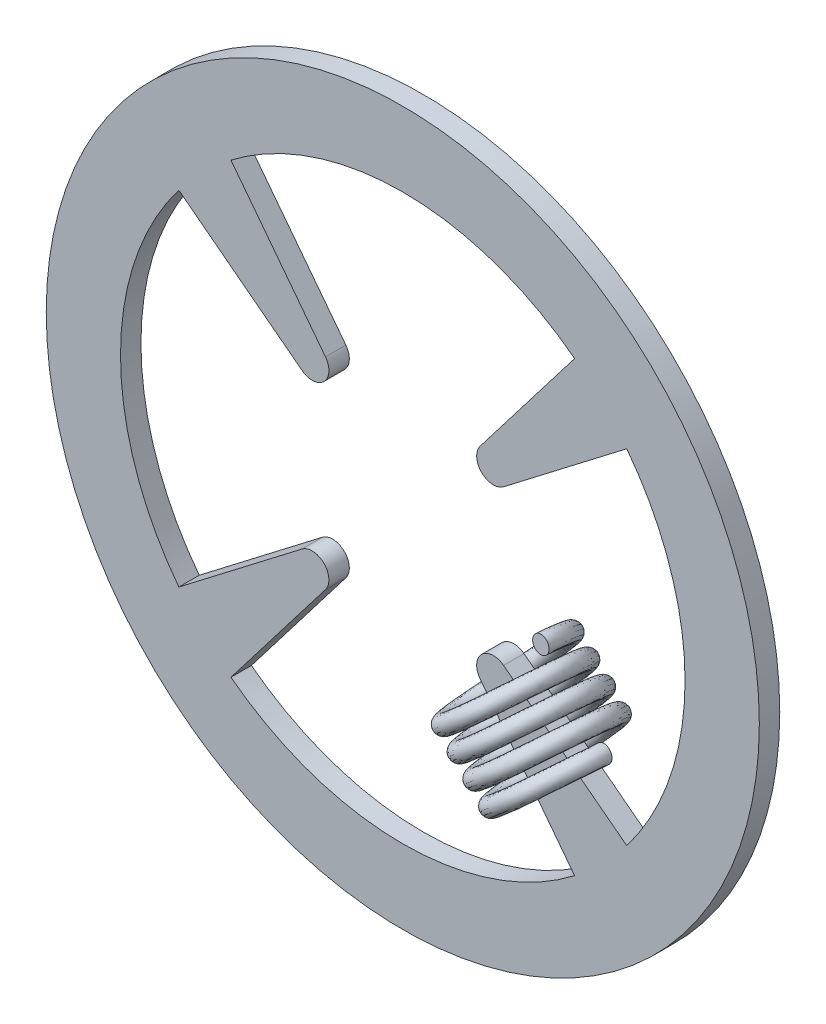
from build123d import *

# Parameters (mm, degrees)
SKETCH_1_R          = 0.96
SKETCH_1_R_2        = 0.76
EXTRUDE_1_DEPTH     = 0.055
EXTRUDE_START       = -0.055
EXTRUDE_2_DEPTH     = 0.055
SWEEP_1_PITCH       = 0.06
SWEEP_1_HEIGHT      = 0.24
SWEEP_1_RADIUS      = 0.15
SWEEP_1_START_ANGLE = 180
SKETCH_71_R         = 0.023


with BuildPart() as part:
    # 草圖1 → 填料-伸長1 (new body)
    with BuildSketch(Plane.XY):
        Circle(SKETCH_1_R)
        Circle(SKETCH_1_R_2, mode=Mode.SUBTRACT)
    extrude(amount=EXTRUDE_1_DEPTH)

    # 草圖2 → 填料-伸長2 (add)
    with BuildSketch(Plane.XY.offset(0.055).offset(EXTRUDE_START)):
        with BuildLine():
            Line((-0.208247811, 0.271393831), (-0.462658686, 0.602948539))
            ThreePointArc((-0.462658686, 0.602948539), (-0.537401154, 0.537401154), (-0.602948539, 0.462658686))
            Line((-0.602948539, 0.462658686), (-0.271393831, 0.208247811))
            ThreePointArc((-0.271393831, 0.208247811), (-0.241031974, 0.199037642), (-0.212132034, 0.212132034))
            ThreePointArc((-0.212132034, 0.212132034), (-0.199037642, 0.241031974), (-0.208247811, 0.271393831))
        make_face()
        with BuildLine():
            ThreePointArc((0.208247811, 0.271393831), (0.199037642, 0.241031974), (0.212132034, 0.212132034))
            ThreePointArc((0.212132034, 0.212132034), (0.241031974, 0.199037642), (0.271393831, 0.208247811))
            Line((0.271393831, 0.208247811), (0.602948539, 0.462658686))
            ThreePointArc((0.602948539, 0.462658686), (0.537401154, 0.537401154), (0.462658686, 0.602948539))
            Line((0.462658686, 0.602948539), (0.208247811, 0.271393831))
        make_face()
        with BuildLine():
            ThreePointArc((0.271393831, -0.208247811), (0.241031974, -0.199037642), (0.212132034, -0.212132034))
            ThreePointArc((0.212132034, -0.212132034), (0.199037642, -0.241031974), (0.208247811, -0.271393831))
            Line((0.208247811, -0.271393831), (0.462658686, -0.602948539))
            ThreePointArc((0.462658686, -0.602948539), (0.537401154, -0.537401154), (0.602948539, -0.462658686))
            Line((0.602948539, -0.462658686), (0.271393831, -0.208247811))
        make_face()
        with BuildLine():
            ThreePointArc((-0.208247811, -0.271393831), (-0.199037642, -0.241031974), (-0.212132034, -0.212132034))
            ThreePointArc((-0.212132034, -0.212132034), (-0.241031974, -0.199037642), (-0.271393831, -0.208247811))
            Line((-0.271393831, -0.208247811), (-0.602948539, -0.462658686))
            ThreePointArc((-0.602948539, -0.462658686), (-0.537401154, -0.537401154), (-0.462658686, -0.602948539))
            Line((-0.462658686, -0.602948539), (-0.208247811, -0.271393831))
        make_face()
    extrude(amount=EXTRUDE_2_DEPTH)


with BuildPart() as body_2:
    # 掃出1: sweep along a helix
    with BuildLine() as sweep_1_path:
        add(Helix(SWEEP_1_PITCH, SWEEP_1_HEIGHT, SWEEP_1_RADIUS, center=(0.240416306, -0.240416306, 0.03), direction=(0.7071067811865475, -0.7071067811865477, 0), lefthand=True, mode=Mode.PRIVATE).rotate(Axis((0.240416306, -0.240416306, 0.03), (0.7071067811865475, -0.7071067811865477, 0)), SWEEP_1_START_ANGLE))
    # 草圖71 → 掃出1 (sweep)
    with BuildSketch(Plane(origin=(0.51618795, -0.304055916, 0.03), x_dir=(-0.9989895775387035, -0.0032772327490316355, -0.044822803510617897), z_dir=(0.04492487103878256, -0.04492487103886298, -0.997979715186782))):
        with Locations((-0.000173743, 0.000137163)):
            Circle(SKETCH_71_R)
    sweep(path=sweep_1_path.line, is_frenet=True)


solid = Compound([part.part, body_2.part])
